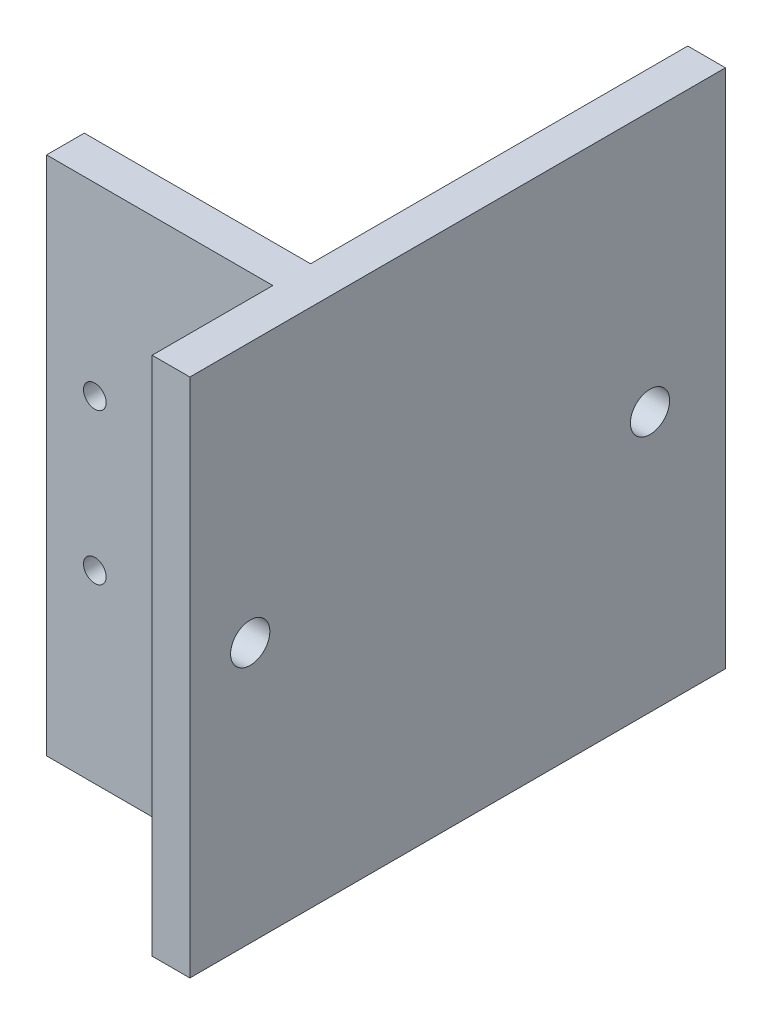
from build123d import *

# Parameters (mm, degrees)
EXTRUDE_1_DEPTH     = 69
HOLE_WIZARD_1_D     = 3
SKETCH_5_R          = 2.6
CUT_EXTRUDE_1_DEPTH = 10
SKETCH_6_R          = 2.6
CUT_EXTRUDE_2_DEPTH = 10
SKETCH_8_W          = 2
SKETCH_8_H          = 10
CUT_EXTRUDE_4_DEPTH = 2


with BuildPart() as part:
    # 草图1 → 凸台-拉伸1 (new body)
    with BuildSketch(Plane(origin=(0, 0, 0), x_dir=(1, 0, 0), z_dir=(0, 1, 0))):
        Polygon((30, 0), (30, 50), (35, 50), (35, -21), (30, -21), (30, -5), (0, -5), (0, 0), align=None)
    extrude(amount=EXTRUDE_1_DEPTH)

    # 孔1 (through all)
    with Locations(Plane.XY.offset(5)):
        with Locations((26.4, 44.5), (26.4, 24.5), (6.4, 44.5), (6.4, 24.5)):
            Hole(HOLE_WIZARD_1_D / 2)

    # 草图5 → 切除-拉伸1 (cut)
    with BuildSketch(Plane.ZY.offset(-30)):
        with Locations((13, 34.5)):
            Circle(SKETCH_5_R)
    extrude(amount=-CUT_EXTRUDE_1_DEPTH, mode=Mode.SUBTRACT)

    # 草图6 → 切除-拉伸2 (cut)
    with BuildSketch(Plane.ZY.offset(-30)):
        with Locations((-40, 34.5)):
            Circle(SKETCH_6_R)
    extrude(amount=-CUT_EXTRUDE_2_DEPTH, mode=Mode.SUBTRACT)

    # 草图8 → 切除-拉伸4 (cut)
    with BuildSketch(Plane.ZY.offset(-30)):
        with Locations((-50, 34.5)):
            Rectangle(SKETCH_8_W, SKETCH_8_H)
    extrude(amount=-CUT_EXTRUDE_4_DEPTH, mode=Mode.SUBTRACT)


solid = part.part
